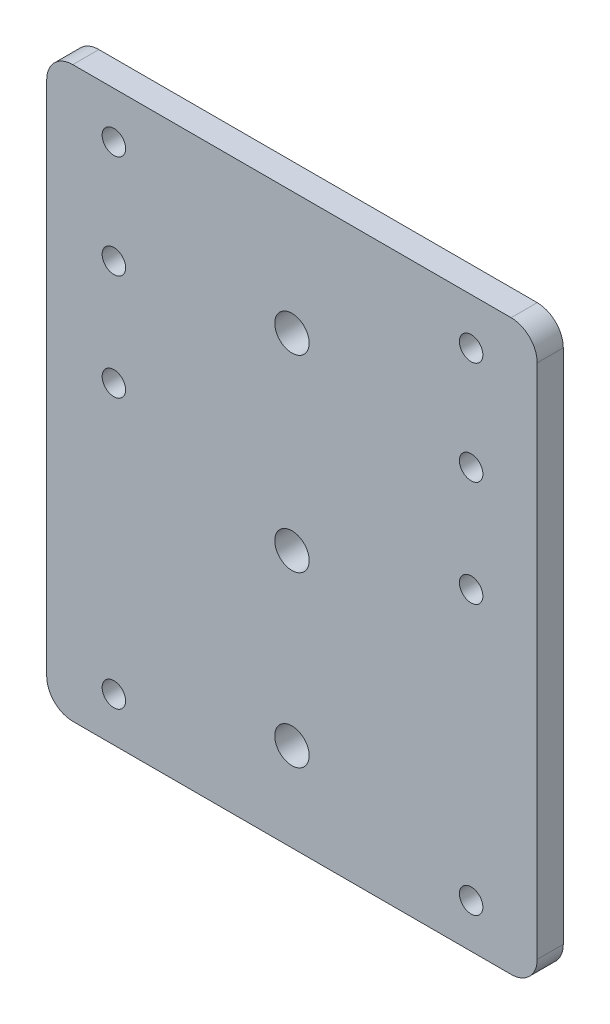
from build123d import *

# Parameters (mm, degrees)
BOSS_EXTRU_1_DEPTH = 5
D_GAGEMENT_M61_D   = 6.6
D_GAGEMENT_M41_D   = 4.5


with BuildPart() as part:
    # Esquisse1 → Boss.-Extru.1 (new body)
    with BuildSketch(Plane.XY):
        with BuildLine():
            Line((-42, 54.5), (42, 54.5))
            ThreePointArc((42, 54.5), (45.535533906, 53.035533906), (47, 49.5))
            Line((47, 49.5), (47, -49.5))
            ThreePointArc((47, -49.5), (45.535533906, -53.035533906), (42, -54.5))
            Line((42, -54.5), (-42, -54.5))
            ThreePointArc((-42, -54.5), (-45.535533906, -53.035533906), (-47, -49.5))
            Line((-47, -49.5), (-47, 49.5))
            ThreePointArc((-47, 49.5), (-45.535533906, 53.035533906), (-42, 54.5))
        make_face()
    extrude(amount=BOSS_EXTRU_1_DEPTH)

    # Dégagement M61 (through all)
    with Locations(Plane.XY.offset(5)):
        with Locations((0, 30.929411148), (0, -37.544992042), (0, -5.15832988)):
            Hole(D_GAGEMENT_M61_D / 2)

    # Dégagement M41 (through all)
    with Locations(Plane.XY.offset(5)):
        with Locations((34.336239969, 45.611301296), (34.336239969, 25.844548243), (34.336239969, 5.572681811), (34.336239969, -46.046219335), (-34.125150255, -46.046219335), (-34.125150255, 5.572681811), (-34.125150255, 25.844548243), (-34.125150255, 45.611301296)):
            Hole(D_GAGEMENT_M41_D / 2)


solid = part.part
